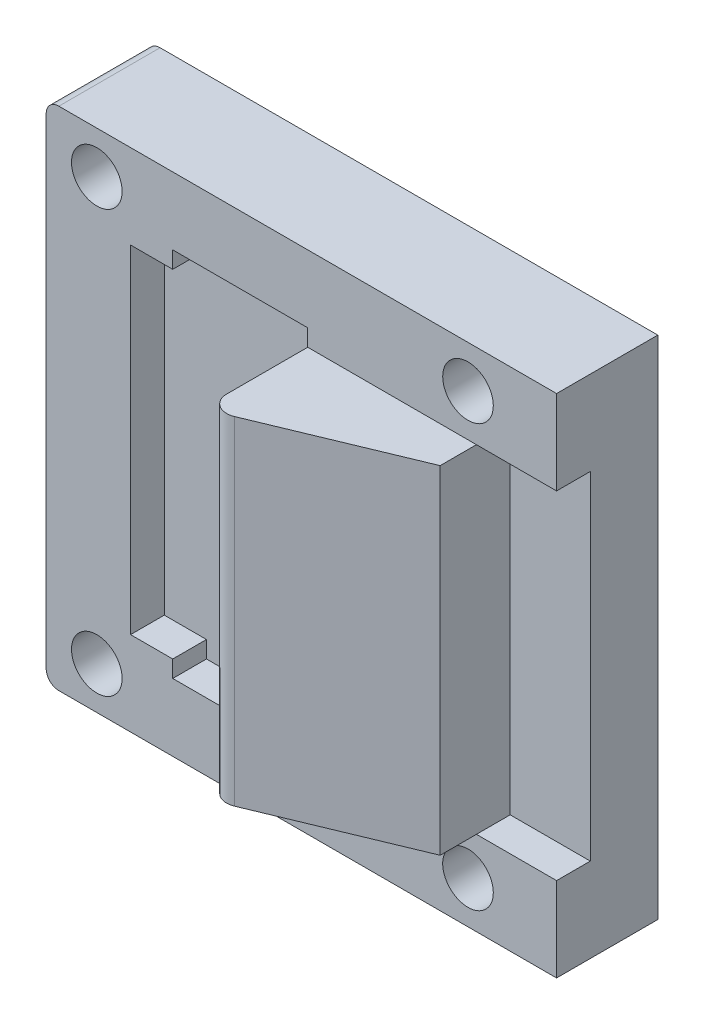
from build123d import *

# Parameters (mm, degrees)
SKETCH1_W                = 30
SKETCH1_H                = 20
BASE_PLATE_DEPTH         = 1
SIDE_WALLS_DEPTH         = 6
SKETCH3_W                = 10
SKETCH3_H                = 20
SWITCH_BLOCK_DEPTH       = 7.15
SKETCH11_W               = 10.5
SKETCH11_H               = 20
SKETCH11_W_2             = 9.5
THICKER_BODY_DEPTH       = 3
SWITCH_BLOCK_ANGLE_DEPTH = 20
SKETCH4_R                = 1.5
M2_SCREWS_DEPTH          = 6
FILLET1_R                = 1
FILLET2_R                = 0.5
FILLET3_R                = 0.5
FILLET4_R                = 0.75
FILLET5_R                = 0.75
SKETCH19_W               = 8
SKETCH19_H               = 22
SPACE_FOR_LEAVER_DEPTH   = 2
SKETCH20_W               = 27.5
SKETCH20_H               = 5
CUT_EXTRUDE1_DEPTH       = 2
CUT_EXTRUDE2_DEPTH       = 26.709920264
CUT_EXTRUDE2_DEPTH_BACK  = 26.709920264
SKETCH21_W               = 19.855195983
SKETCH21_H               = 41.088440975


with BuildPart() as part:
    # Sketch1 → Base Plate (new body)
    with BuildSketch(Plane.XY):
        Rectangle(SKETCH1_W, SKETCH1_H)
    extrude(amount=BASE_PLATE_DEPTH)

    # Sketch2 → Side Walls (add)
    with BuildSketch(Plane(origin=(0, 0, 0), x_dir=(1, 0, 0), z_dir=(0, 0, -1))):
        Polygon((15, 10), (-15, 10), (-15, -10), (15, -10), (15, -15), (-20, -15), (-20, 15), (15, 15), align=None)
    extrude(amount=-SIDE_WALLS_DEPTH)

    # Sketch3 → Switch Block (add)
    with BuildSketch(Plane.XY.offset(1)):
        with Locations((0.5, 0)):
            Rectangle(SKETCH3_W, SKETCH3_H)
    extrude(amount=SWITCH_BLOCK_DEPTH)

    # Sketch11 → Thicker Body (add)
    with BuildSketch(Plane.XY.offset(1)):
        with Locations((-9.75, 0)):
            Rectangle(SKETCH11_W, SKETCH11_H)
        with Locations((10.25, 0)):
            Rectangle(SKETCH11_W_2, SKETCH11_H)
    extrude(amount=THICKER_BODY_DEPTH)

    # Sketch5 → Switch Block Angle (add)
    with BuildSketch(Plane(origin=(0, 10, 0), x_dir=(-1, 0, 0), z_dir=(0, 1, 0))):
        Polygon((4.5, 8.15), (4.5, 12.3), (-5.5, 8.15), align=None)
    extrude(amount=-SWITCH_BLOCK_ANGLE_DEPTH)

    # Sketch4 → M2 Screws (cut)
    with BuildSketch(Plane.XY.offset(6)):
        with Locations((-17, -12.5)):
            Circle(SKETCH4_R)
        with Locations((5, -12.5)):
            Circle(SKETCH4_R)
        with Locations((5, 12.5)):
            Circle(SKETCH4_R)
        with Locations((-17, 12.5)):
            Circle(SKETCH4_R)
    extrude(amount=-M2_SCREWS_DEPTH, mode=Mode.SUBTRACT)

    # Fillet1
    fillet1_edges = [part.edges().sort_by_distance(p)[0] for p in [
        (-4.5, 0, 12.3),
    ]]
    fillet(fillet1_edges, radius=FILLET1_R)

    # Fillet2
    fillet2_edges = [part.edges().sort_by_distance(p)[0] for p in [
        (15, -15, 3),
    ]]
    fillet(fillet2_edges, radius=FILLET2_R)

    # Fillet3
    fillet3_edges = [part.edges().sort_by_distance(p)[0] for p in [
        (15, 15, 3),
    ]]
    fillet(fillet3_edges, radius=FILLET3_R)

    # Fillet4
    fillet4_edges = [part.edges().sort_by_distance(p)[0] for p in [
        (-20, 15, 3),
    ]]
    fillet(fillet4_edges, radius=FILLET4_R)

    # Fillet5
    fillet5_edges = [part.edges().sort_by_distance(p)[0] for p in [
        (-20, -15, 3),
    ]]
    fillet(fillet5_edges, radius=FILLET5_R)

    # Sketch19 → Space for LEaver (cut)
    with BuildSketch(Plane.XY.offset(6)):
        with Locations((-8.5, 0)):
            Rectangle(SKETCH19_W, SKETCH19_H)
    extrude(amount=-SPACE_FOR_LEAVER_DEPTH, mode=Mode.SUBTRACT)

    # Sketch20 → Cut-Extrude1 (cut)
    with BuildSketch(Plane(origin=(0, 0, 0), x_dir=(1, 0, 0), z_dir=(0, 0, -1))):
        with Locations((-6.25, 0)):
            Rectangle(SKETCH20_W, SKETCH20_H)
    extrude(amount=-CUT_EXTRUDE1_DEPTH, mode=Mode.SUBTRACT)

    # Sketch21 → Cut-Extrude2 (cut, two sides: drawn at the far end of the back side and taken through both)
    with BuildSketch(Plane.XY.offset(6).offset(-CUT_EXTRUDE2_DEPTH_BACK)):
        with Locations((20.177597992, -2.746626802)):
            Rectangle(SKETCH21_W, SKETCH21_H)
    extrude(amount=CUT_EXTRUDE2_DEPTH + CUT_EXTRUDE2_DEPTH_BACK, mode=Mode.SUBTRACT)


solid = part.part
